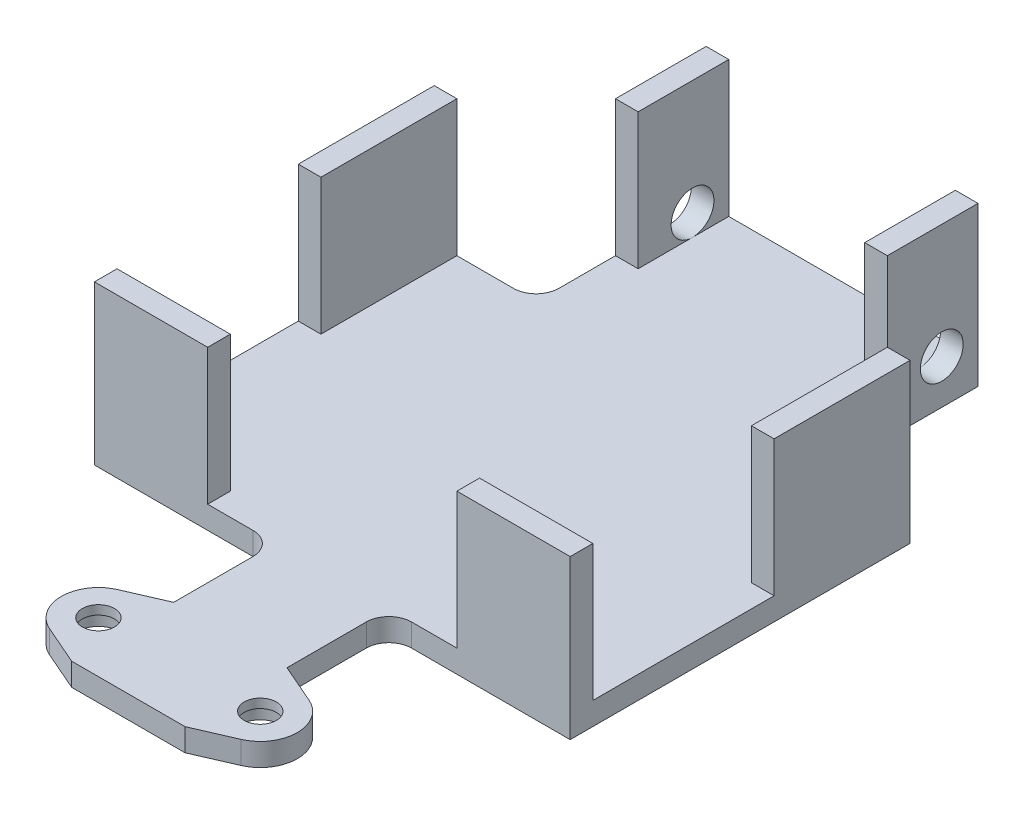
from build123d import *

# Parameters (mm, degrees)
SKETCH1_R           = 6
BOSS_EXTRUDE1_DEPTH = 6.35
SKETCH2_W           = 6.35
SKETCH2_H           = 38.1
SKETCH2_W_2         = 31.75
SKETCH2_H_2         = 6.35
MOTORMOUNT_DEPTH    = 38.1
SKETCH4_W           = 6.35
SKETCH4_H           = 25.4
WHEELMOUNTS_DEPTH   = 38.1
FILLET1_R           = 6.35
BOSS_EXTRUDE4_START = -2.54
SKETCH5_R           = 6
SKETCH5_R_2         = 4.5
BOSS_EXTRUDE4_DEPTH = 2.54
SKETCH6_R           = 6
CUT_EXTRUDE2_DEPTH  = 83.947
FILLET2_R           = 6.35


with BuildPart() as part:
    # Sketch1 → Boss-Extrude1 (new body)
    with BuildSketch(Plane(origin=(0, 0, 0), x_dir=(1, 0, 0), z_dir=(0, 1, 0))):
        with BuildLine():
            Line((50.8, 0), (50.8, -28.575))
            Line((50.8, -28.575), (39.852082176, -33.3375))
            ThreePointArc((39.852082176, -33.3375), (33.608374366, -42.8625), (39.852082176, -52.3875))
            Line((39.852082176, -52.3875), (50.8, -57.15))
            Line((50.8, -57.15), (82.55, -57.15))
            Line((82.55, -57.15), (93.497917824, -52.3875))
            ThreePointArc((93.497917824, -52.3875), (99.741625634, -42.8625), (93.497917824, -33.3375))
            Line((93.497917824, -33.3375), (82.55, -28.575))
            Line((82.55, -28.575), (82.55, 0))
            Line((82.55, 0), (133.35, 0))
            Line((133.35, 0), (133.35, 95.25))
            Line((133.35, 95.25), (104.775, 95.25))
            Line((104.775, 95.25), (104.775, 142.875))
            Line((104.775, 142.875), (28.575, 142.875))
            Line((28.575, 142.875), (28.575, 95.25))
            Line((28.575, 95.25), (0, 95.25))
            Line((0, 95.25), (0, 0))
            Line((0, 0), (50.8, 0))
        make_face()
        with Locations(Location((89.354407321, -42.8625, 0), (0, 0, 270))):
            Circle(SKETCH1_R, mode=Mode.SUBTRACT)
        with Locations(Location((43.995592679, -42.8625, 0), (0, 0, 90))):
            Circle(SKETCH1_R, mode=Mode.SUBTRACT)
    extrude(amount=BOSS_EXTRUDE1_DEPTH)

    # Sketch2 → MotorMount (add)
    with BuildSketch(Plane(origin=(0, 6.35, 0), x_dir=(1, 0, 0), z_dir=(0, 1, 0))):
        with Locations((130.175, 76.2)):
            Rectangle(SKETCH2_W, SKETCH2_H)
        with Locations((3.175, 76.2)):
            Rectangle(SKETCH2_W, SKETCH2_H)
        with Locations((15.875, 3.175)):
            Rectangle(SKETCH2_W_2, SKETCH2_H_2)
        with Locations((117.475, 3.175)):
            Rectangle(SKETCH2_W_2, SKETCH2_H_2)
    extrude(amount=MOTORMOUNT_DEPTH)

    # Sketch4 → WheelMounts (add)
    with BuildSketch(Plane(origin=(0, 6.35, 0), x_dir=(1, 0, 0), z_dir=(0, 1, 0))):
        with Locations((101.6, 130.175)):
            Rectangle(SKETCH4_W, SKETCH4_H)
        with Locations((31.75, 130.175)):
            Rectangle(SKETCH4_W, SKETCH4_H)
    extrude(amount=WHEELMOUNTS_DEPTH)

    # Fillet1
    fillet1_edges = [part.edges().sort_by_distance(p)[0] for p in [
        (82.55, 3.175, 0),
        (50.8, 3.175, 0),
    ]]
    fillet(fillet1_edges, radius=FILLET1_R)

    # Sketch5 → Boss-Extrude4 (add)
    # profile 1 of 2: a face of its own
    with BuildSketch(Plane(origin=(0, 6.35, 0), x_dir=(1, 0, 0), z_dir=(0, 1, 0)).offset(BOSS_EXTRUDE4_START)):
        with Locations(Location((43.995592679, -42.8625, 0), (0, 0, 90))):
            Circle(SKETCH5_R)
        with Locations(Location((43.995592679, -42.8625, 0), (0, 0, 270))):
            Circle(SKETCH5_R_2, mode=Mode.SUBTRACT)
    # profile 2 of 2: a face of its own
    with BuildSketch(Plane(origin=(0, 6.35, 0), x_dir=(1, 0, 0), z_dir=(0, 1, 0)).offset(BOSS_EXTRUDE4_START)):
        with Locations(Location((89.354407321, -42.8625, 0), (0, 0, 270))):
            Circle(SKETCH5_R)
        with Locations(Location((89.354407321, -42.8625, 0), (0, 0, 270))):
            Circle(SKETCH5_R_2, mode=Mode.SUBTRACT)
    extrude(amount=BOSS_EXTRUDE4_DEPTH)

    # Sketch6 → Cut-Extrude2 (cut)
    with BuildSketch(Plane(origin=(104.775, 0, 0), x_dir=(0, 0, -1), z_dir=(1, 0, 0))):
        with Locations((132.715, 12.35)):
            Circle(SKETCH6_R)
    extrude(amount=-CUT_EXTRUDE2_DEPTH, mode=Mode.SUBTRACT)

    # Fillet2
    fillet2_edges = [part.edges().sort_by_distance(p)[0] for p in [
        (28.575, 3.175, -95.25),
        (104.775, 3.175, -95.25),
    ]]
    fillet(fillet2_edges, radius=FILLET2_R)


solid = part.part
